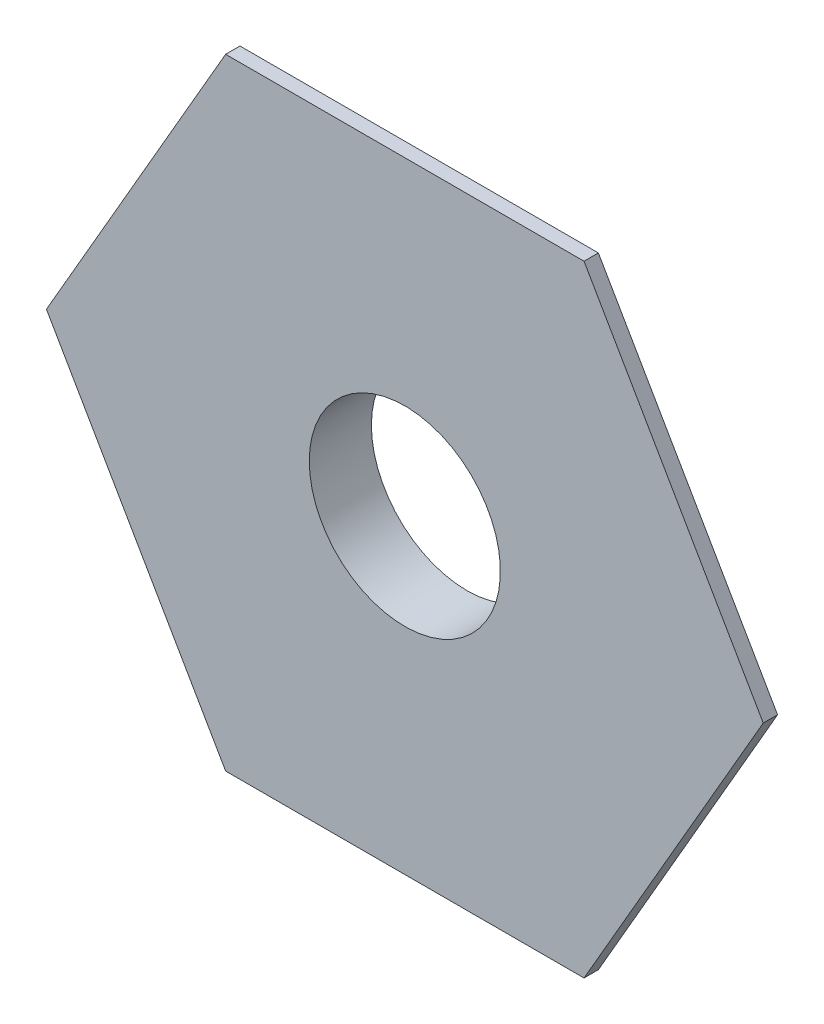
from build123d import *

# Parameters (mm, degrees)
SKETCH_1_R               = 37.5
EXTRUDE_1_DEPTH          = 3
SKETCH_2_R               = 25
CUT_EXTRUDE_1_DEPTH      = 3
SKETCH_3_R               = 1.5
CUT_EXTRUDE_2_DEPTH      = 13
PATTERN_CIRCULAR_1_COUNT = 8
EXTRUDE_2_DEPTH          = 5
EXTRUDE_2_DEPTH_BACK     = 10
SKETCH_4_R               = 25
SKETCH_4_R_2             = 20
SKETCH_7_R               = 28.195307437
CUT_EXTRUDE_3_DEPTH      = 5
EXTRUDE_3_DEPTH          = 3
CUT_EXTRUDE_4_DEPTH      = 100.718353376
CUT_EXTRUDE_4_DEPTH_BACK = 100.718353376
SKETCH_9_R               = 20


with BuildPart() as part:
    # 草图1 → 凸台-拉伸1 (new body)
    with BuildSketch(Plane.XY):
        Circle(SKETCH_1_R)
    extrude(amount=EXTRUDE_1_DEPTH)

    # 草图2 → 切除-拉伸1 (cut)
    with BuildSketch(Plane(origin=(0, 0, 0), x_dir=(-1, 0, 0), z_dir=(0, 0, -1))):
        Circle(SKETCH_2_R)
    extrude(amount=-CUT_EXTRUDE_1_DEPTH, mode=Mode.SUBTRACT)

    # 草图3 → 切除-拉伸2 (cut)
    with BuildSketch(Plane.XY.offset(3)):
        with Locations((0, -30)):
            Circle(SKETCH_3_R)
    cut_extrude_2 = extrude(amount=-CUT_EXTRUDE_2_DEPTH, mode=Mode.SUBTRACT)

    # 阵列(圆周)1: 切除-拉伸2 ×8 about axis
    pattern_circular_1_axis = Axis((0, 0, 0), (0, 0, 1))
    for i in range(1, PATTERN_CIRCULAR_1_COUNT):
        add(cut_extrude_2.rotate(pattern_circular_1_axis, i * 360 / PATTERN_CIRCULAR_1_COUNT), mode=Mode.SUBTRACT)

    # 草图4 → 凸台-拉伸2 (add, two sides: drawn at the far end of the back side and taken through both)
    with BuildSketch(Plane.XY.offset(3).offset(-EXTRUDE_2_DEPTH_BACK)):
        with Locations(Location((0, 0, 0), (0, 0, 180))):
            Circle(SKETCH_4_R)
        Circle(SKETCH_4_R_2, mode=Mode.SUBTRACT)
    extrude(amount=EXTRUDE_2_DEPTH + EXTRUDE_2_DEPTH_BACK)

    # 草图7 → 切除-拉伸3 (cut)
    with BuildSketch(Plane.XY.offset(8)):
        Circle(SKETCH_7_R)
    extrude(amount=-CUT_EXTRUDE_3_DEPTH, mode=Mode.SUBTRACT)

    # 草图8 → 凸台-拉伸3 (add)
    with BuildSketch(Plane.XY.offset(3)):
        Polygon((37.5, 64.951905284), (-37.5, 64.951905284), (-75, 0), (-37.5, -64.951905284), (37.5, -64.951905284), (75, 0), align=None)
    extrude(amount=EXTRUDE_3_DEPTH)

    # 草图9 → 切除-拉伸4 (cut, two sides: drawn at the far end of the back side and taken through both)
    with BuildSketch(Plane(origin=(0, 0, 3), x_dir=(-1, 0, 0), z_dir=(0, 0, -1)).offset(-CUT_EXTRUDE_4_DEPTH_BACK)):
        Circle(SKETCH_9_R)
    extrude(amount=CUT_EXTRUDE_4_DEPTH + CUT_EXTRUDE_4_DEPTH_BACK, mode=Mode.SUBTRACT)


solid = part.part
